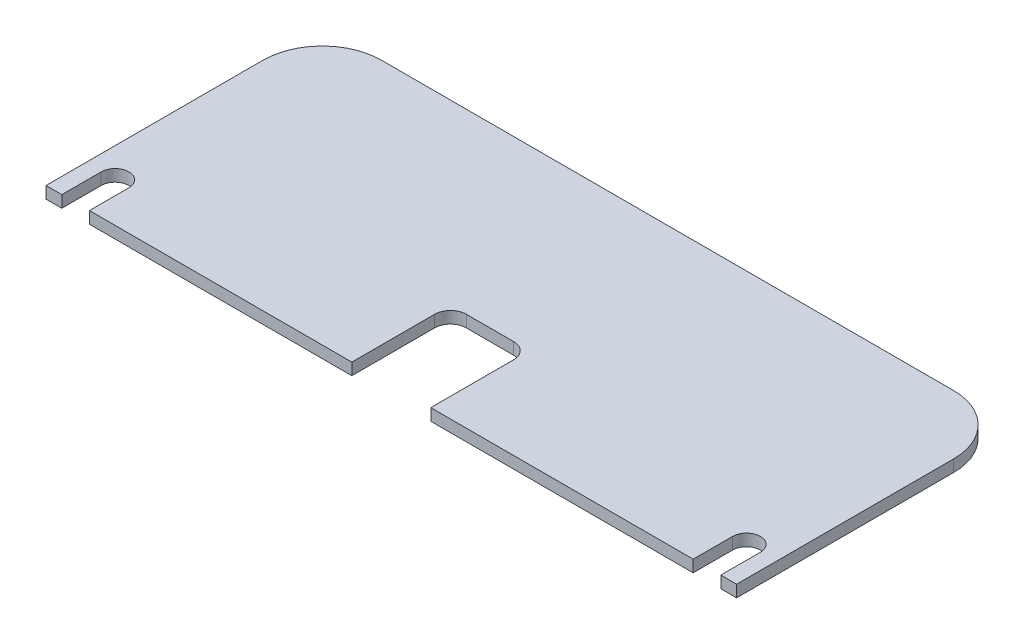
from build123d import *

# Parameters (mm, degrees)
SKETCH1_W           = 175
SKETCH1_H           = 70
BOSS_EXTRUDE1_DEPTH = 3
SKETCH2_W           = 20
SKETCH2_H           = 25
CUT_EXTRUDE1_DEPTH  = 5
FILLET1_R           = 4
FILLET2_R           = 15


with BuildPart() as part:
    # Sketch1 → Boss-Extrude1 (new body)
    with BuildSketch(Plane(origin=(0, 0, 0), x_dir=(1, 0, 0), z_dir=(0, 1, 0))):
        with Locations((87.5, 35)):
            Rectangle(SKETCH1_W, SKETCH1_H)
    extrude(amount=BOSS_EXTRUDE1_DEPTH)

    # Sketch2 → Cut-Extrude1 (cut)
    with BuildSketch(Plane(origin=(0, 3, 0), x_dir=(1, 0, 0), z_dir=(0, 1, 0))):
        with Locations((87.5, 12.5)):
            Rectangle(SKETCH2_W, SKETCH2_H)
        with BuildLine():
            Line((11, 10), (11, 0))
            Line((11, 0), (4, 0))
            Line((4, 0), (4, 10))
            ThreePointArc((4, 10), (7.5, 13.5), (11, 10))
        make_face()
        with BuildLine():
            Line((171, 0), (171, 10))
            ThreePointArc((171, 10), (167.5, 13.5), (164, 10))
            Line((164, 10), (164, 0))
            Line((164, 0), (171, 0))
        make_face()
    extrude(amount=-CUT_EXTRUDE1_DEPTH, mode=Mode.SUBTRACT)

    # Fillet1
    fillet1_edges = [part.edges().sort_by_distance(p)[0] for p in [
        (77.5, 1.5, -25),
        (97.5, 1.5, -25),
    ]]
    fillet(fillet1_edges, radius=FILLET1_R)

    # Fillet2
    fillet2_edges = [part.edges().sort_by_distance(p)[0] for p in [
        (0, 1.5, -70),
        (175, 1.5, -70),
    ]]
    fillet(fillet2_edges, radius=FILLET2_R)


solid = part.part
